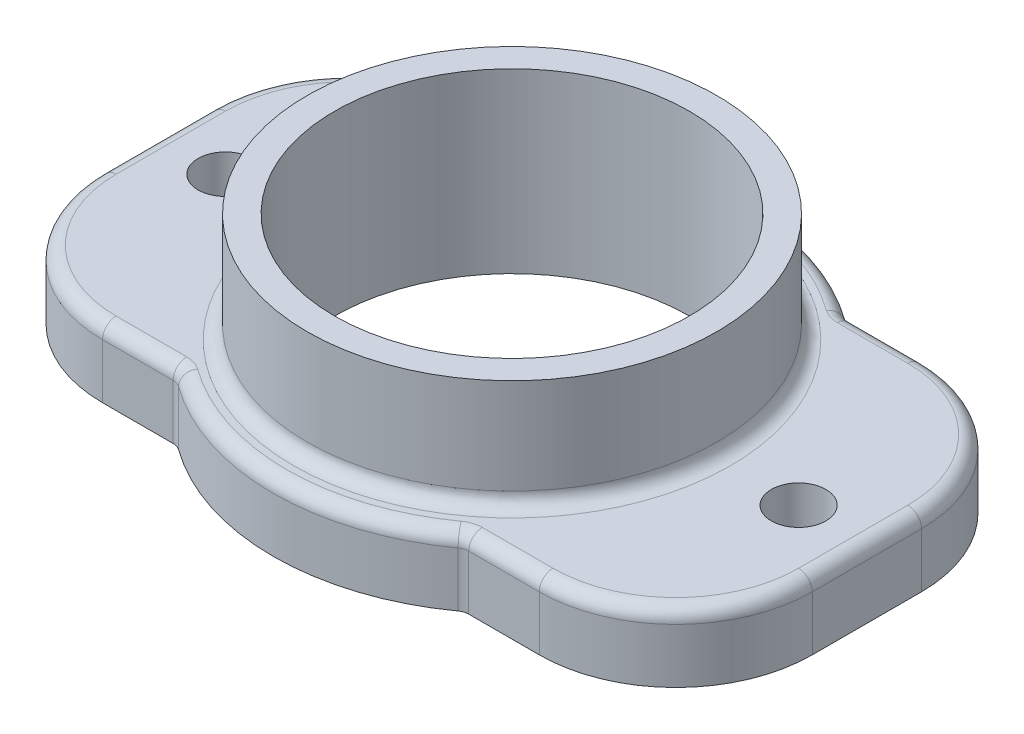
from build123d import *

# Parameters (mm, degrees)
SKETCH_1_W          = 52
SKETCH_1_H          = 28
EXTRUDE_1_DEPTH     = 5
SKETCH_2_R          = 17.5
EXTRUDE_2_DEPTH     = 5
SKETCH_3_R          = 15
EXTRUDE_3_DEPTH     = 8
SKETCH_4_R          = 13
CUT_EXTRUDE_1_DEPTH = 34.930075155
FILLET_1_R          = 10
SKETCH_5_R          = 2
CUT_EXTRUDE_2_DEPTH = 34.930075155
FILLET_2_R          = 1
FILLET_3_R          = 1
FILLET_4_R          = 1


with BuildPart() as part:
    # 草圖1 → 填料-伸長1 (new body)
    with BuildSketch(Plane(origin=(0, 0, 0), x_dir=(1, 0, 0), z_dir=(0, 1, 0))):
        Rectangle(SKETCH_1_W, SKETCH_1_H)
    extrude(amount=EXTRUDE_1_DEPTH)

    # 草圖2 → 填料-伸長2 (add)
    with BuildSketch(Plane(origin=(0, 0, 0), x_dir=(1, 0, 0), z_dir=(0, 1, 0))):
        Circle(SKETCH_2_R)
    extrude(amount=EXTRUDE_2_DEPTH)

    # 草圖3 → 填料-伸長3 (add)
    with BuildSketch(Plane(origin=(0, 5, 0), x_dir=(1, 0, 0), z_dir=(0, 1, 0))):
        with Locations(Location((0, 0, 0), (0, 0, 270))):
            Circle(SKETCH_3_R)
    extrude(amount=EXTRUDE_3_DEPTH)

    # 草圖4 → 除料-伸長1 (cut, through all)
    with BuildSketch(Plane(origin=(0, 13, 0), x_dir=(1, 0, 0), z_dir=(0, 1, 0))):
        with Locations(Location((0, 0, 0), (0, 0, 270))):
            Circle(SKETCH_4_R)
    extrude(amount=-CUT_EXTRUDE_1_DEPTH, mode=Mode.SUBTRACT)

    # 圓角1
    fillet_1_edges = [part.edges().sort_by_distance(p)[0] for p in [
        (-26, 2.5, -14),
        (26, 2.5, -14),
        (26, 2.5, 14),
        (-26, 2.5, 14),
    ]]
    fillet(fillet_1_edges, radius=FILLET_1_R)

    # 草圖5 → 除料-伸長2 (cut, through all)
    with BuildSketch(Plane.XZ):
        with Locations(Location((-21, 0, 0), (0, 0, 270))):
            Circle(SKETCH_5_R)
    cut_extrude_2 = extrude(amount=-CUT_EXTRUDE_2_DEPTH, mode=Mode.SUBTRACT)

    # 鏡射1: 除料-伸長2 across plane
    add(cut_extrude_2.mirror(Plane(origin=(0, 0, 0), x_dir=(0, 0, 1), z_dir=(1, 0, 0))), mode=Mode.SUBTRACT)

    # 圓角2
    fillet_2_edges = [part.edges().sort_by_distance(p)[0] for p in [
        (0, 5, -15),
    ]]
    fillet(fillet_2_edges, radius=FILLET_2_R)

    # 圓角3
    fillet_3_edges = [part.edges().sort_by_distance(p)[0] for p in [
        (10.5, 2.5, 14),
        (-10.5, 2.5, 14),
        (-10.5, 2.5, -14),
        (10.5, 2.5, -14),
    ]]
    fillet(fillet_3_edges, radius=FILLET_3_R)

    # 圓角4
    fillet_4_edges = [part.edges().sort_by_distance(p)[0] for p in [
        (13.414101957, 5, -14),
        (26, 5, 0),
        (-26, 5, 0),
        (-13.414101957, 5, 14),
        (-23.071067812, 5, -11.071067812),
        (-23.071067812, 5, 11.071067812),
        (23.071067812, 5, 11.071067812),
        (23.071067812, 5, -11.071067812),
        (0, 5, -17.5),
        (-13.414101957, 5, -14),
        (0, 5, 17.5),
        (13.414101957, 5, 14),
        (10.520641571, 5, -14.048472068),
        (-10.520641571, 5, -14.048472068),
        (-10.520641571, 5, 14.048472068),
        (10.520641571, 5, 14.048472068),
    ]]
    fillet(fillet_4_edges, radius=FILLET_4_R)


solid = part.part
